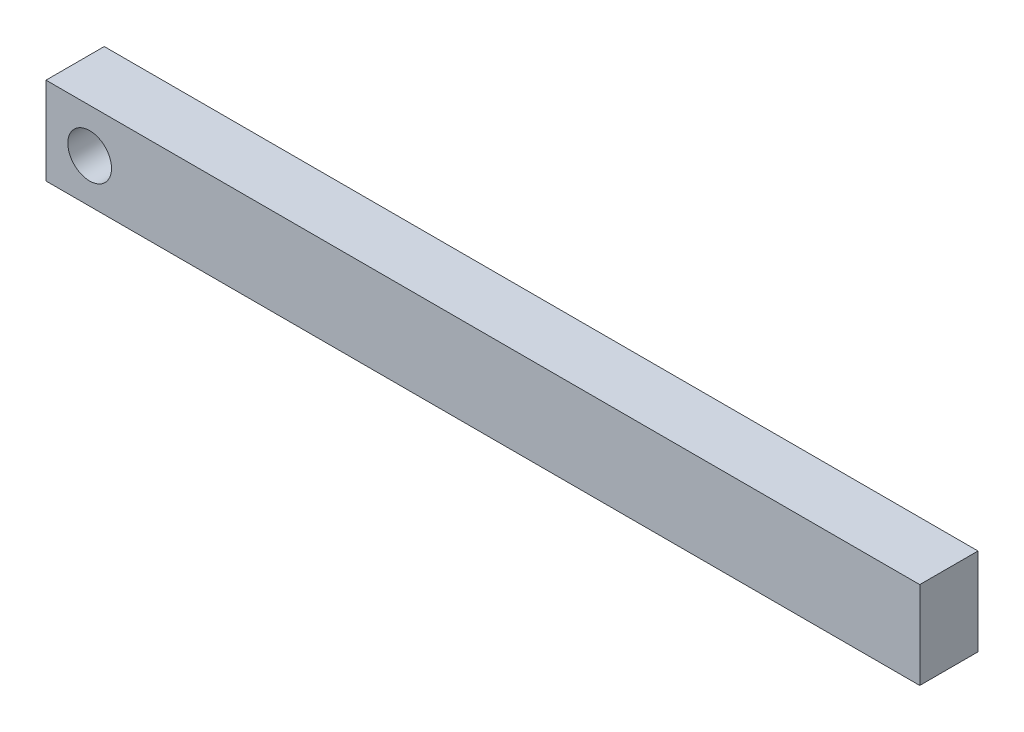
from build123d import *

# Parameters (mm, degrees)
CROQUIS1_W              = 762
CROQUIS1_H              = 76.2
SALIENTE_EXTRUIR1_DEPTH = 50.8
CROQUIS2_R              = 19.05
CORTAR_EXTRUIR5_DEPTH   = 387.255420674


with BuildPart() as part:
    # Croquis1 → Saliente-Extruir1 (new body)
    with BuildSketch(Plane.XY):
        Rectangle(CROQUIS1_W, CROQUIS1_H)
    extrude(amount=SALIENTE_EXTRUIR1_DEPTH)

    # Croquis2 → Cortar-Extruir5 (cut, through all)
    with BuildSketch(Plane(origin=(0, 0, 0), x_dir=(-1, 0, 0), z_dir=(0, 0, -1))):
        with Locations(Location((342.9, 0, 0), (0, 0, 180))):
            Circle(CROQUIS2_R)
    extrude(amount=-CORTAR_EXTRUIR5_DEPTH, mode=Mode.SUBTRACT)


solid = part.part
